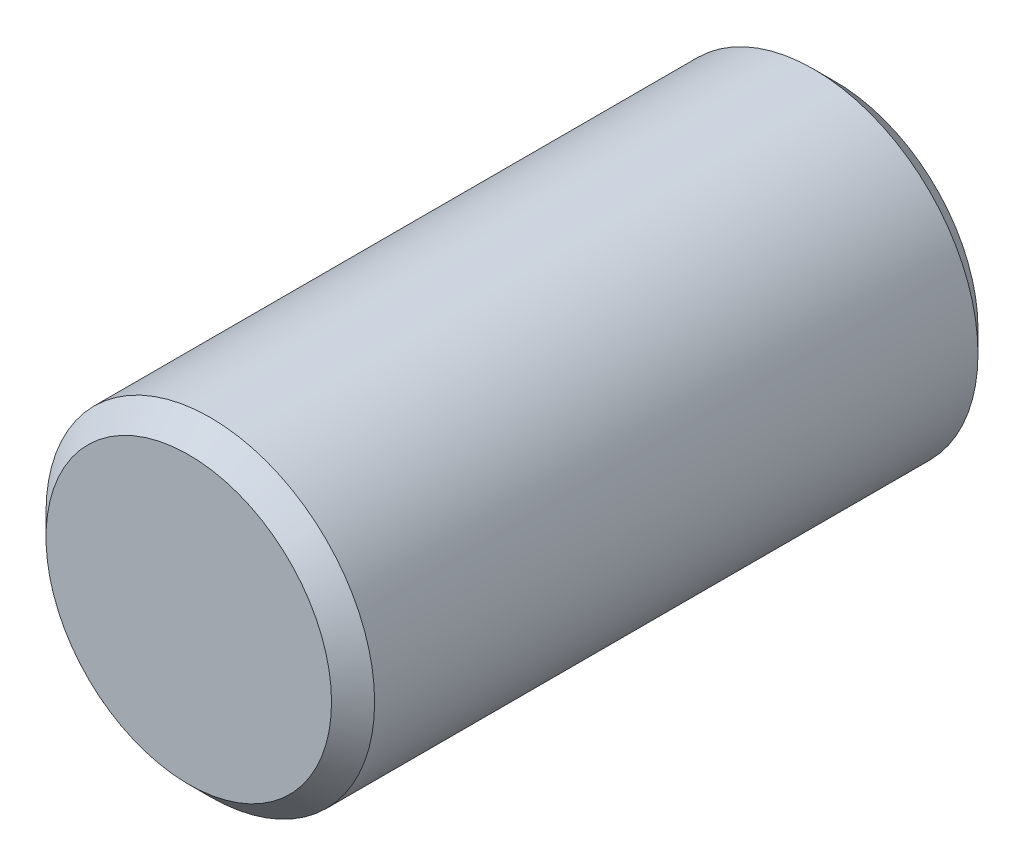
from build123d import *

# Parameters (mm, degrees)
SKETCH_1_R      = 1.525
EXTRUDE_1_DEPTH = 6
CHAMFER_1_SIZE  = 0.2


with BuildPart() as part:
    # 草图1 → 凸台-拉伸1 (new body)
    with BuildSketch(Plane.XY):
        Circle(SKETCH_1_R)
    extrude(amount=EXTRUDE_1_DEPTH)

    # 倒角1
    chamfer_1_edges = [part.edges().sort_by_distance(p)[0] for p in [
        (-1.525, 0, 0),
        (-1.525, 0, 6),
    ]]
    chamfer(chamfer_1_edges, length=CHAMFER_1_SIZE)


solid = part.part
